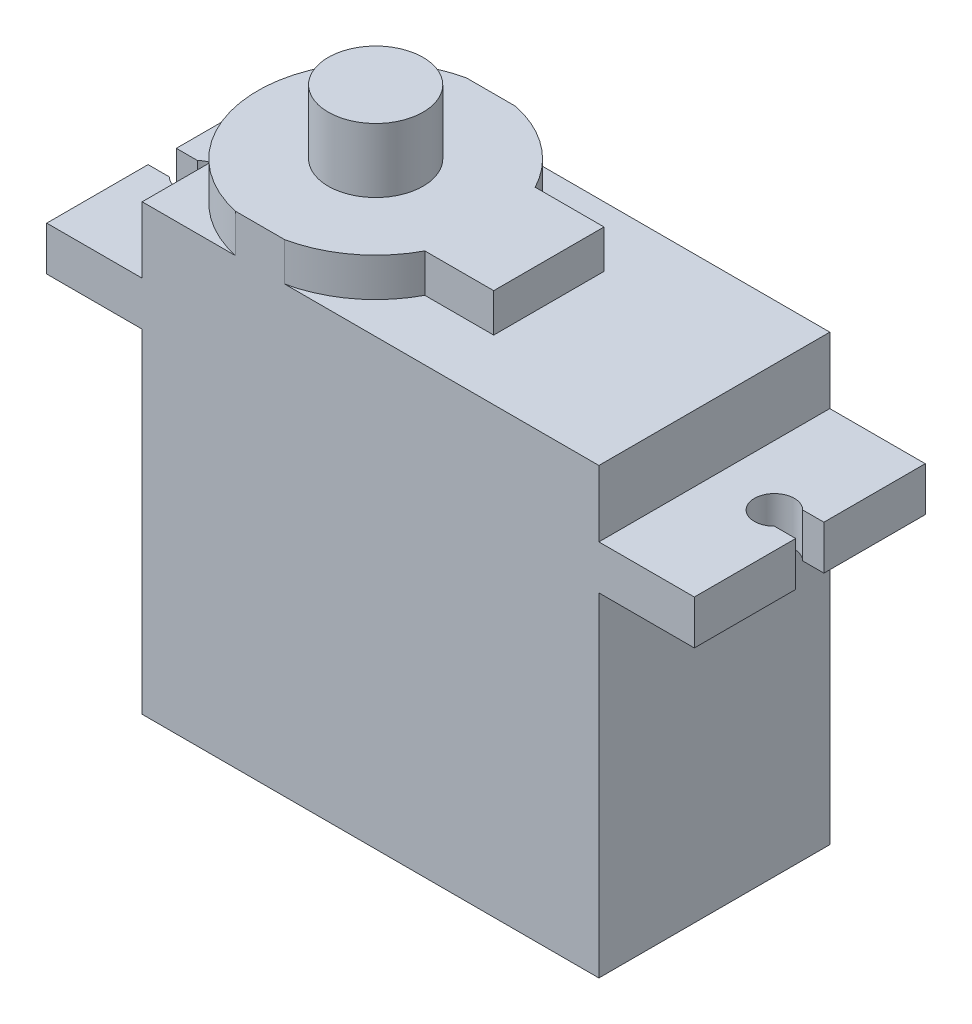
from build123d import *

# Parameters (mm, degrees)
SKETCH1_W           = 22.606
SKETCH1_H           = 11.43
BOSS_EXTRUDE1_DEPTH = 21.971
BOSS_EXTRUDE2_DEPTH = 2.1844
BOSS_EXTRUDE3_DEPTH = 1.905
SKETCH5_R           = 2.3495
BOSS_EXTRUDE4_DEPTH = 3.175


with BuildPart() as part:
    # Sketch1 → Boss-Extrude1 (new body)
    with BuildSketch(Plane(origin=(0, 0, 0), x_dir=(1, 0, 0), z_dir=(0, 1, 0))):
        with Locations((11.303, 5.715)):
            Rectangle(SKETCH1_W, SKETCH1_H)
    extrude(amount=BOSS_EXTRUDE1_DEPTH)

    # Sketch3 → Boss-Extrude2 (add)
    with BuildSketch(Plane(origin=(0, 16.51, 0), x_dir=(1, 0, 0), z_dir=(0, 1, 0))):
        with BuildLine():
            Line((0, 0), (-4.7244, 0))
            Line((-4.7244, 0), (-4.7244, 5.0165))
            Line((-4.7244, 5.0165), (-3.674214486, 5.0165))
            ThreePointArc((-3.674214486, 5.0165), (-1.9812, 5.715), (-3.674214486, 6.4135))
            Line((-3.674214486, 6.4135), (-4.7244, 6.4135))
            Line((-4.7244, 6.4135), (-4.7244, 11.43))
            Line((-4.7244, 11.43), (0, 11.43))
            Line((0, 11.43), (0, 0))
        make_face()
    boss_extrude2 = extrude(amount=BOSS_EXTRUDE2_DEPTH)

    # Sketch4 → Boss-Extrude3 (add)
    with BuildSketch(Plane(origin=(0, 21.971, 0), x_dir=(1, 0, 0), z_dir=(0, 1, 0))):
        with BuildLine():
            Line((4.630497214, 11.43), (7.053502786, 11.43))
            ThreePointArc((7.053502786, 11.43), (9.362022159, 10.377446568), (11.006623292, 8.4455))
            Line((11.006623292, 8.4455), (14.4145, 8.4455))
            Line((14.4145, 8.4455), (14.4145, 2.9845))
            Line((14.4145, 2.9845), (11.006623292, 2.9845))
            ThreePointArc((11.006623292, 2.9845), (9.362022159, 1.052553432), (7.053502786, 0))
            Line((7.053502786, 0), (4.630497214, 0))
            ThreePointArc((4.630497214, 0), (0, 5.715), (4.630497214, 11.43))
        make_face()
    extrude(amount=BOSS_EXTRUDE3_DEPTH)

    # Sketch5 → Boss-Extrude4 (add)
    with BuildSketch(Plane(origin=(0, 23.876, 0), x_dir=(1, 0, 0), z_dir=(0, 1, 0))):
        with Locations(Location((5.842, 5.715, 0), (0, 0, 270))):
            Circle(SKETCH5_R)
    extrude(amount=BOSS_EXTRUDE4_DEPTH)

    # Mirror1: Boss-Extrude2 across plane
    add(boss_extrude2.mirror(Plane(origin=(11.303, 0, 0), x_dir=(0, 0, 1), z_dir=(1, 0, 0))))


solid = part.part
